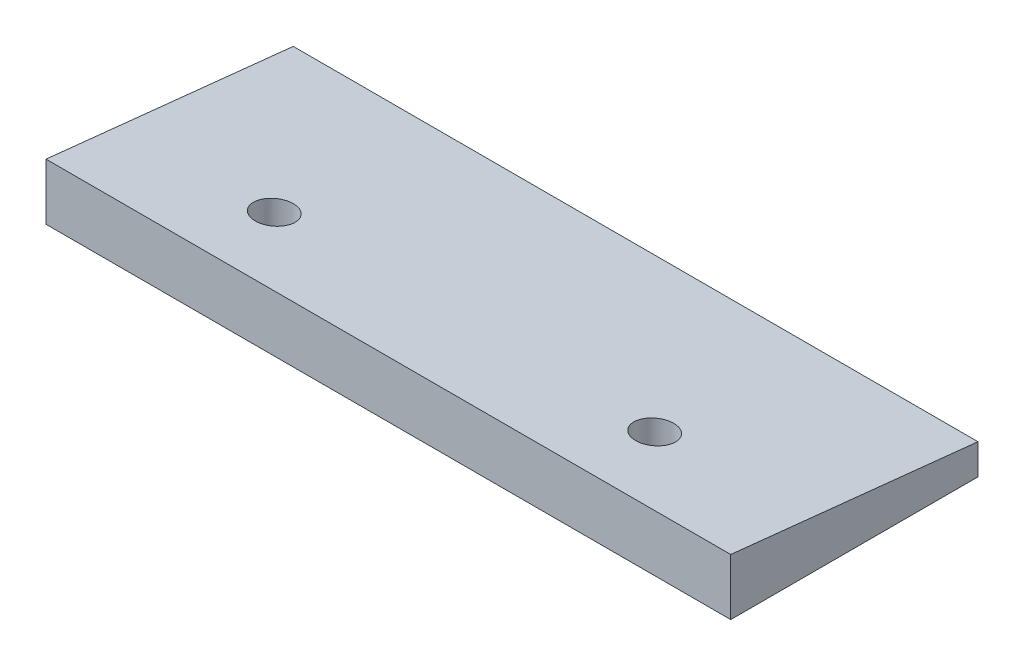
from build123d import *

# Parameters (mm, degrees)
BOSS_EXTRUDE1_DEPTH            = 90
CBORE_FOR_M5_SHCS1_D           = 5.5
CBORE_FOR_M5_SHCS1_CBORE_D     = 10
CBORE_FOR_M5_SHCS1_CBORE_DEPTH = 15


with BuildPart() as part:
    # Sketch2 → Boss-Extrude1 (new, symmetric)
    with BuildSketch(Plane(origin=(0, 0, 0), x_dir=(0, 0, -1), z_dir=(1, 0, 0))):
        Polygon((0, 0), (0, 8), (-65, 14.831775292), (-65, 0), align=None)
    extrude(amount=BOSS_EXTRUDE1_DEPTH, both=True)

    # CBORE for M5 SHCS1 (through all)
    with Locations(Plane(origin=(0, 20, -0.836227706), x_dir=(1, 0, 0), z_dir=(0, 1, 0))):
        with Locations((-50, -45.836227706), (50, -45.836227706)):
            CounterBoreHole(CBORE_FOR_M5_SHCS1_D / 2, CBORE_FOR_M5_SHCS1_CBORE_D / 2, CBORE_FOR_M5_SHCS1_CBORE_DEPTH)


solid = part.part
